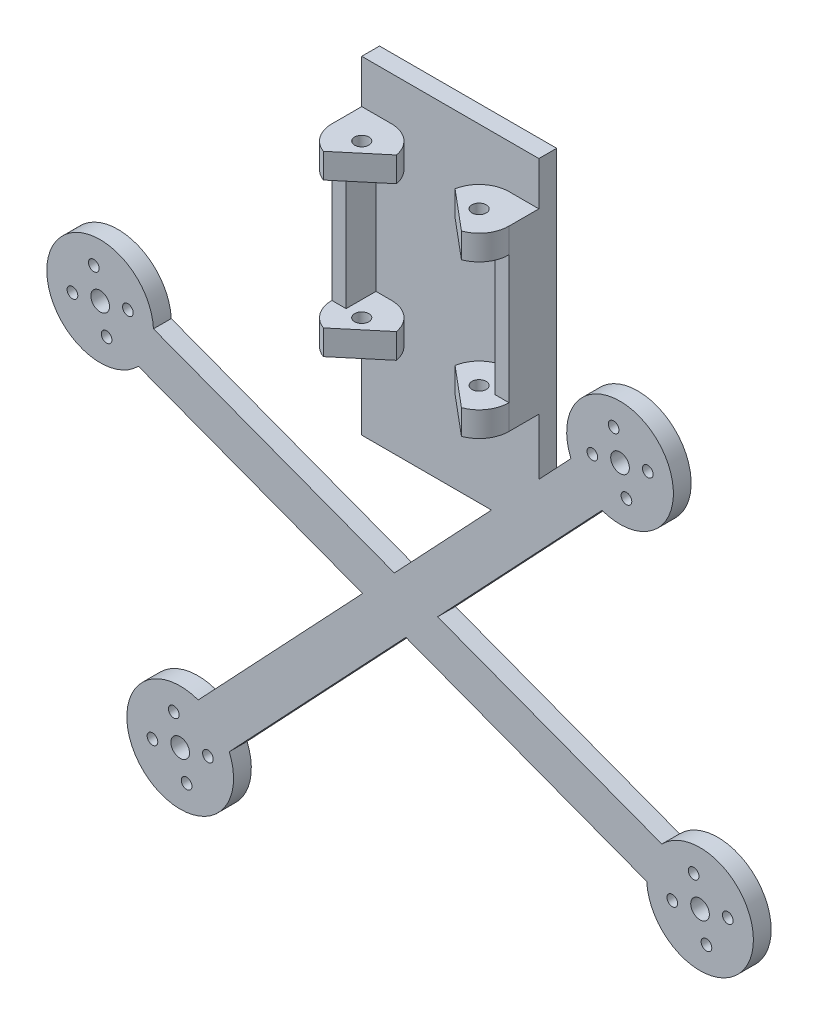
from build123d import *

# Parameters (mm, degrees)
BOSS_EXTRUDE2_DEPTH     = 7
CUT_EXTRUDE2_DEPTH      = 30.130224853
CUT_EXTRUDE2_DEPTH_BACK = 30.130224853
SKETCH3_R               = 2
BOSS_EXTRUDE3_DEPTH     = 36
SKETCH5_R               = 2
BOSS_EXTRUDE4_DEPTH     = 7
SKETCH13_W              = 49.8
SKETCH13_H              = 5
BOSS_EXTRUDE6_DEPTH     = 12.25
SKETCH15_W              = 49.8
SKETCH15_H              = 5
BOSS_EXTRUDE7_DEPTH     = 30
SKETCH12_R              = 1.5
SKETCH12_R_2            = 2.625
BOSS_EXTRUDE8_DEPTH     = 5


with BuildPart() as part:
    # Sketch1 → Boss-Extrude2 (new body)
    with BuildSketch(Plane(origin=(0, 0, 0), x_dir=(1, 0, 0), z_dir=(0, 1, 0))):
        with BuildLine():
            Line((-24.9, 0), (-24.9, 13.4))
            Line((-24.9, 13.4), (24.9, 13.4))
            Line((24.9, 13.4), (24.9, 0))
            ThreePointArc((24.9, 0), (23.392904185, -4.800819919), (19.412411454, -7.878950407))
            Line((19.412411454, -7.878950407), (8.235013612, 1.5))
            ThreePointArc((8.235013612, 1.5), (11.116692467, 6.448255578), (16.5, 8.4))
            Line((16.5, 8.4), (-16.5, 8.4))
            ThreePointArc((-16.5, 8.4), (-11.116692467, 6.448255578), (-8.235013612, 1.5))
            Line((-8.235013612, 1.5), (-19.412411454, -7.878950407))
            ThreePointArc((-19.412411454, -7.878950407), (-23.392904185, -4.800819919), (-24.9, 0))
        make_face()
    extrude(amount=BOSS_EXTRUDE2_DEPTH)

    # Sketch3 → Cut-Extrude2 (cut, two sides: drawn at the far end of the back side and taken through both)
    with BuildSketch(Plane(origin=(0, 7, 0), x_dir=(1, 0, 0), z_dir=(0, 1, 0)).offset(-CUT_EXTRUDE2_DEPTH_BACK)):
        with Locations(Location((-16.5, 0, 0), (0, 0, 270))):
            Circle(SKETCH3_R)
        with Locations(Location((16.5, 0, 0), (0, 0, 270))):
            Circle(SKETCH3_R)
    extrude(amount=CUT_EXTRUDE2_DEPTH + CUT_EXTRUDE2_DEPTH_BACK, mode=Mode.SUBTRACT)

    # Sketch4 → Boss-Extrude3 (add)
    with BuildSketch(Plane(origin=(0, 7, 0), x_dir=(1, 0, 0), z_dir=(0, 1, 0))):
        Polygon((-24.9, 13.4), (-24.9, 0), (-20.9, 0), (-20.9, 8.4), (-16.5, 8.4), (16.5, 8.4), (20.9, 8.4), (20.9, 0), (24.9, 0), (24.9, 13.4), align=None)
    extrude(amount=BOSS_EXTRUDE3_DEPTH)

    # Sketch5 → Boss-Extrude4 (add)
    with BuildSketch(Plane(origin=(0, 43, 0), x_dir=(1, 0, 0), z_dir=(0, 1, 0))):
        with BuildLine():
            Line((-24.9, 13.4), (-24.9, 0))
            ThreePointArc((-24.9, 0), (-23.392904185, -4.800819919), (-19.412411454, -7.878950407))
            Line((-19.412411454, -7.878950407), (-8.235013612, 1.5))
            ThreePointArc((-8.235013612, 1.5), (-11.116692467, 6.448255578), (-16.5, 8.4))
            Line((-16.5, 8.4), (16.5, 8.4))
            ThreePointArc((16.5, 8.4), (11.116692467, 6.448255578), (8.235013612, 1.5))
            Line((8.235013612, 1.5), (19.412411454, -7.878950407))
            ThreePointArc((19.412411454, -7.878950407), (23.392904185, -4.800819919), (24.9, 0))
            Line((24.9, 0), (24.9, 13.4))
            Line((24.9, 13.4), (-24.9, 13.4))
        make_face()
        with Locations(Location((16.5, 0, 0), (0, 0, 270))):
            Circle(SKETCH5_R, mode=Mode.SUBTRACT)
        with Locations(Location((-16.5, 0, 0), (0, 0, 270))):
            Circle(SKETCH5_R, mode=Mode.SUBTRACT)
    extrude(amount=BOSS_EXTRUDE4_DEPTH)

    # Sketch13 → Boss-Extrude6 (add)
    with BuildSketch(Plane(origin=(0, 50, 0), x_dir=(1, 0, 0), z_dir=(0, 1, 0))):
        with Locations((0, 10.9)):
            Rectangle(SKETCH13_W, SKETCH13_H)
    extrude(amount=BOSS_EXTRUDE6_DEPTH)

    # Sketch15 → Boss-Extrude7 (add)
    with BuildSketch(Plane.XZ):
        with Locations((0, -10.9)):
            Rectangle(SKETCH15_W, SKETCH15_H)
    extrude(amount=BOSS_EXTRUDE7_DEPTH)

    # Sketch12 → Boss-Extrude8 (add)
    with BuildSketch(Plane(origin=(0, 0, -13.4), x_dir=(-1, 0, 0), z_dir=(0, 0, -1))):
        with BuildLine():
            Line((3.57214695, -63.566782317), (-59.47254153, -87.376896171))
            ThreePointArc((-59.47254153, -87.376896171), (-84.246316334, -103.146864291), (-55.232789428, -98.602959689))
            Line((-55.232789428, -98.602959689), (12.489425518, -73.02628246))
            Line((12.489425518, -73.02628246), (62.145671786, -125.701912707))
            ThreePointArc((62.145671786, -125.701912707), (86.23094036, -142.504640172), (70.877518071, -117.470578644))
            Line((70.877518071, -117.470578644), (24.650994329, -68.433217683))
            Line((24.650994329, -68.433217683), (87.69568281, -44.623103829))
            ThreePointArc((87.69568281, -44.623103829), (112.469457614, -28.853135709), (83.455930708, -33.397040311))
            Line((83.455930708, -33.397040311), (15.733715762, -58.97371754))
            Line((15.733715762, -58.97371754), (-33.922530506, -6.298087293))
            ThreePointArc((-33.922530506, -6.298087293), (-58.00779908, 10.504640172), (-42.654376791, -14.529421356))
            Line((-42.654376791, -14.529421356), (3.57214695, -63.566782317))
        make_face()
        with Locations((-49.518239937, -8.205128203)):
            Circle(SKETCH12_R, mode=Mode.SUBTRACT)
        with Locations((-55.51359202, 1.38944075)):
            Circle(SKETCH12_R, mode=Mode.SUBTRACT)
        with Locations((-45.919023067, 7.384792833)):
            Circle(SKETCH12_R, mode=Mode.SUBTRACT)
        with Locations((-39.923670984, -2.20977612)):
            Circle(SKETCH12_R, mode=Mode.SUBTRACT)
        with Locations(Location((-62.418776418, -99.646782598, 0), (0, 0, 180))):
            Circle(SKETCH12_R, mode=Mode.SUBTRACT)
        with Locations(Location((-72.013345371, -105.642134682, 0), (0, 0, 180))):
            Circle(SKETCH12_R, mode=Mode.SUBTRACT)
        with Locations(Location((-68.414128501, -90.052213645, 0), (0, 0, 180))):
            Circle(SKETCH12_R, mode=Mode.SUBTRACT)
        with Locations(Location((-78.008697455, -96.047565729, 0), (0, 0, 180))):
            Circle(SKETCH12_R, mode=Mode.SUBTRACT)
        with Locations(Location((100.236486651, -26.357865318, 0), (0, 0, 180))):
            Circle(SKETCH12_R, mode=Mode.SUBTRACT)
        with Locations(Location((90.641917698, -32.353217402, 0), (0, 0, 180))):
            Circle(SKETCH12_R, mode=Mode.SUBTRACT)
        with Locations(Location((96.637269781, -41.947786355, 0), (0, 0, 180))):
            Circle(SKETCH12_R, mode=Mode.SUBTRACT)
        with Locations(Location((106.231838734, -35.952434271, 0), (0, 0, 180))):
            Circle(SKETCH12_R, mode=Mode.SUBTRACT)
        with Locations((68.146812263, -129.79022388)):
            Circle(SKETCH12_R, mode=Mode.SUBTRACT)
        with Locations((77.741381216, -123.794871797)):
            Circle(SKETCH12_R, mode=Mode.SUBTRACT)
        with Locations((83.7367333, -133.38944075)):
            Circle(SKETCH12_R, mode=Mode.SUBTRACT)
        with Locations((74.142164347, -139.384792833)):
            Circle(SKETCH12_R, mode=Mode.SUBTRACT)
        with Locations((-47.718631502, -0.410167685)):
            Circle(SKETCH12_R_2, mode=Mode.SUBTRACT)
        with Locations(Location((-70.213736936, -97.847174163, 0), (0, 0, 180))):
            Circle(SKETCH12_R_2, mode=Mode.SUBTRACT)
        with Locations(Location((98.436878216, -34.152825837, 0), (0, 0, 180))):
            Circle(SKETCH12_R_2, mode=Mode.SUBTRACT)
        with Locations((75.941772782, -131.589832315)):
            Circle(SKETCH12_R_2, mode=Mode.SUBTRACT)
    extrude(amount=-BOSS_EXTRUDE8_DEPTH)


solid = part.part
